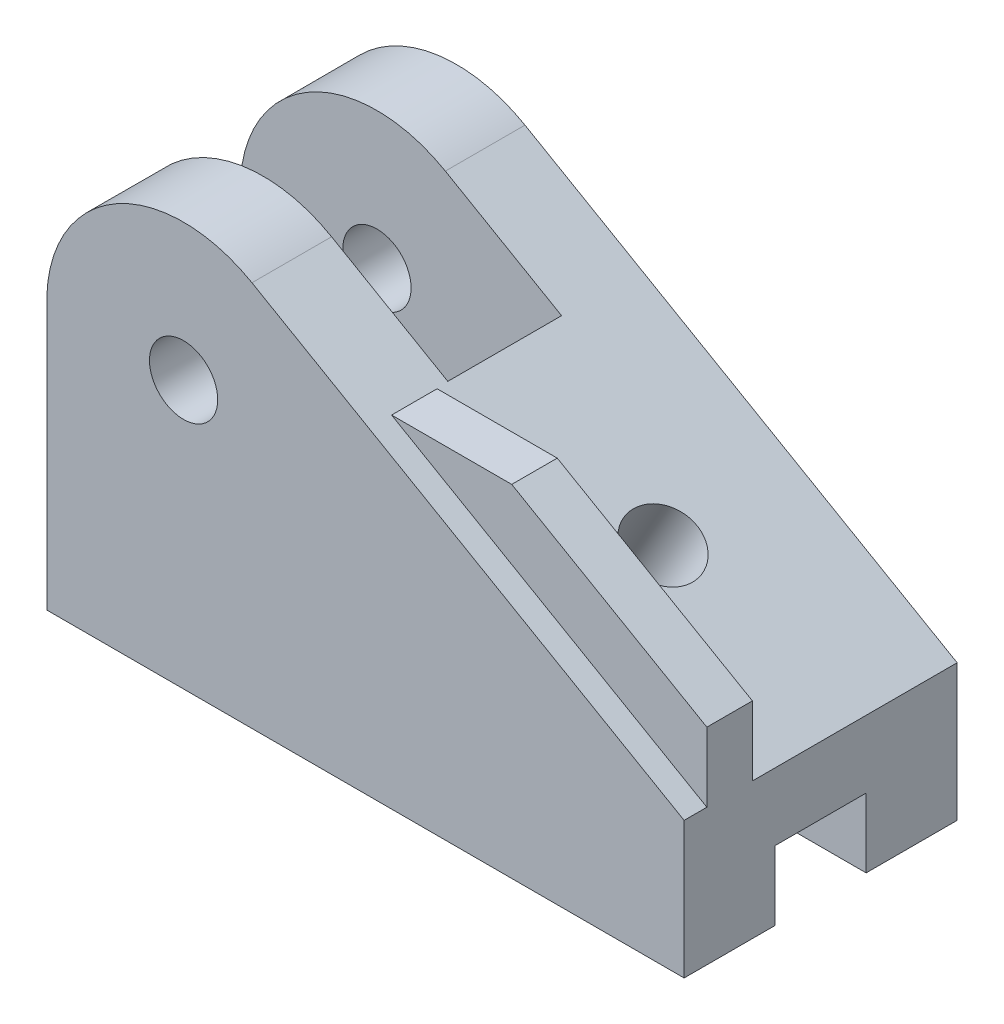
from build123d import *

# Parameters (mm, degrees)
BOSS_EXTRUDE1_DEPTH          = 19.05
SKETCH2_W                    = 12.7
SKETCH2_H                    = 9.652
CUT_EXTRUDE1_DEPTH           = 108.035088344
BOSS_EXTRUDE2_DEPTH          = 3.175
CUT_EXTRUDE12_DEPTH          = 7.9375
F_1_2_0_375_DIAMETER_HOLE1_D = 9.525
F_1_2_0_375_DIAMETER_HOLE2_D = 9.525


with BuildPart() as part:
    # Sketch1 → Boss-Extrude1 (new, symmetric)
    with BuildSketch(Plane.XY):
        with BuildLine():
            Line((0, 36.148070179), (0, 0))
            Line((0, 0), (88.9, 0))
            Line((88.9, 0), (88.9, 19.05))
            Line((88.9, 19.05), (28.593563708, 53.867937227))
            ThreePointArc((28.593563708, 53.867937227), (8.995572876, 53.562269727), (0, 36.148070179))
        make_face()
    extrude(amount=BOSS_EXTRUDE1_DEPTH, both=True)

    # Sketch2 → Cut-Extrude1 (cut, through all)
    with BuildSketch(Plane(origin=(88.9, 0, 0), x_dir=(0, 0, -1), z_dir=(1, 0, 0))):
        with Locations((0, 4.826)):
            Rectangle(SKETCH2_W, SKETCH2_H)
    extrude(amount=-CUT_EXTRUDE1_DEPTH, mode=Mode.SUBTRACT)

    # Sketch3 → Boss-Extrude2 (add, symmetric)
    with BuildSketch(Plane.XY.offset(12.7)):
        Polygon((88.9, 28.728699913), (61.669909488, 44.45), (44.905909488, 44.45), (88.9, 19.05), align=None)
    extrude(amount=BOSS_EXTRUDE2_DEPTH, both=True)

    # Sketch17 → Cut-Extrude12 (cut, symmetric)
    with BuildSketch(Plane.XY):
        Polygon((0, 25.4), (33.782, 25.4), (51.929375197, 56.832175865), (0, 56.832175865), align=None)
    extrude(amount=CUT_EXTRUDE12_DEPTH, both=True, mode=Mode.SUBTRACT)

    # 1/2 (0.375) Diameter Hole1 (through all)
    with Locations(Plane(origin=(30.473891971, 52.782329198, 0), x_dir=(0.8660254037844419, -0.4999999999999945, 0), z_dir=(0.49999999999999445, 0.8660254037844418, 0))):
        with Locations((42.064658396, 0)):
            Hole(F_1_2_0_375_DIAMETER_HOLE1_D / 2)

    # 1/2 (0.375) Diameter Hole2 (through all)
    with Locations(Plane.XY.offset(19.05)):
        with Locations((19.05, 37.338)):
            Hole(F_1_2_0_375_DIAMETER_HOLE2_D / 2)


solid = part.part
